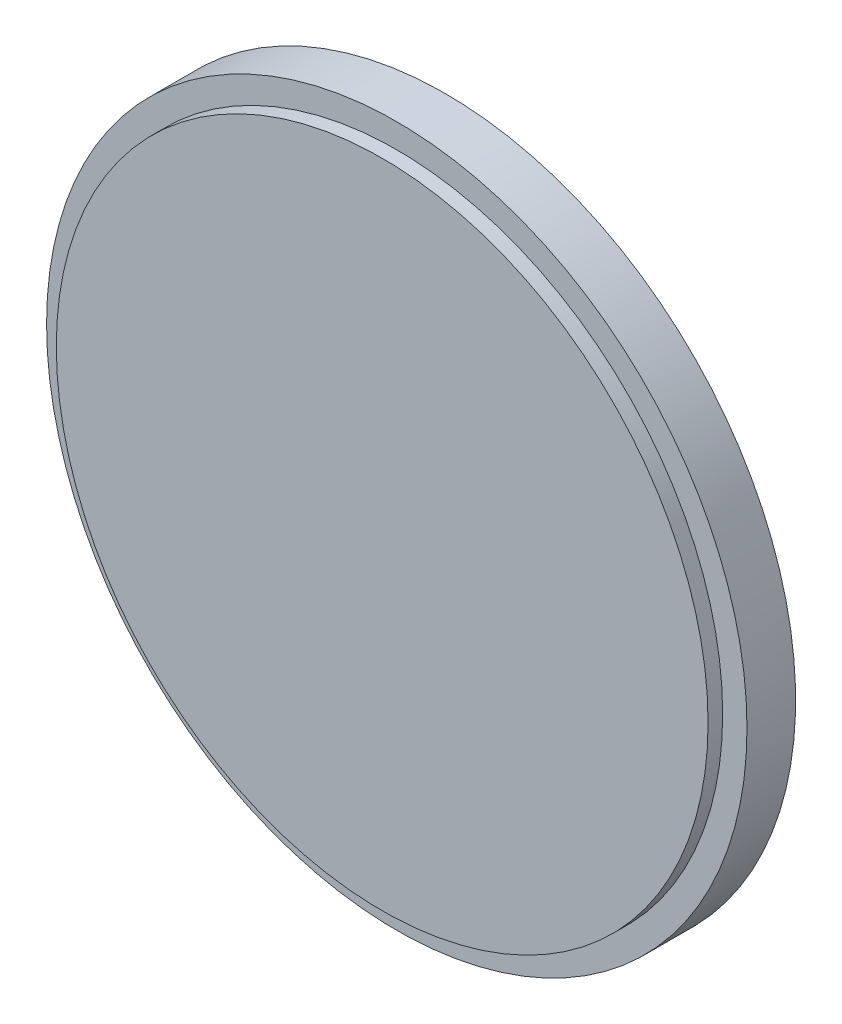
from build123d import *

# Parameters (mm, degrees)
ESBO_O1_R                     = 35
ESBO_O1_R_2                   = 32.5
RESSALTO_EXTRUS_O1_DEPTH      = 8
RESSALTO_EXTRUS_O2_START      = -3
ESBO_O2_R                     = 32.5
RESSALTO_EXTRUS_O2_DEPTH      = 3
ESBO_O3_R                     = 2.5
CORTE_EXTRUS_O1_DEPTH         = 3
RESSALTO_EXTRUS_O3_DEPTH      = 5
RESSALTO_EXTRUS_O3_DEPTH_BACK = 3
ESBO_O4_R                     = 37
ESBO_O4_R_2                   = 35
ESBO_O5_W                     = 1.8
ESBO_O5_H                     = 3
ESBO_O6_R                     = 12.55
RESSALTO_EXTRUS_O4_DEPTH      = 5
CORTE_EXTRUS_O2_DEPTH         = 53.933921071
CORTE_EXTRUS_O2_DEPTH_BACK    = 53.933921071
ESBO_O7_R                     = 7.55
RESSALTO_EXTRUS_O5_START      = -8
ESBO_O8_R                     = 37
ESBO_O8_R_2                   = 32.5
RESSALTO_EXTRUS_O5_DEPTH      = 8
ESBO_O9_R                     = 37
ESBO_O9_R_2                   = 33.5
CORTE_EXTRUS_O8_DEPTH         = 1.5
CORTE_EXTRUS_O9_START         = -1.5
ESBO_O12_R                    = 37
ESBO_O12_R_2                  = 33.5
CORTE_EXTRUS_O9_DEPTH         = 1.5
CORTE_EXTRUS_O10_START        = -10
ESBO_O13_R                    = 37
ESBO_O13_R_2                  = 36
CORTE_EXTRUS_O10_DEPTH        = 10
ESBO_O14_R                    = 37
ESBO_O14_R_2                  = 36
RESSALTO_EXTRUS_O6_DEPTH      = 5
ESBO_O15_R                    = 12.55
CORTE_EXTRUS_O11_DEPTH        = 53.933921071
ESBO_O16_R                    = 12.55
RESSALTO_EXTRUS_O7_DEPTH      = 3
ESBO_O17_R                    = 10
RESSALTO_EXTRUS_O8_DEPTH      = 16
ESBO_O18_R                    = 3.3
CORTE_EXTRUS_O12_DEPTH        = 16
ESBO_O19_W                    = 5.95
ESBO_O19_H                    = 2.65
CORTE_EXTRUS_O13_DEPTH        = 8
ESBO_O23_R                    = 37
ESBO_O23_R_2                  = 36
CORTE_EXTRUS_O15_DEPTH        = 54.798234172
ESBO_O24_R                    = 3.3
RESSALTO_EXTRUS_O9_DEPTH      = 11
CORTE_EXTRUS_O14_DEPTH        = 56.88103435
CORTE_EXTRUS_O14_DEPTH_BACK   = 56.88103435
ESBO_O21_R                    = 1.65


with BuildPart() as part:
    # Esboço1 → Ressalto-extrusão1 (new body)
    with BuildSketch(Plane.XY):
        Circle(ESBO_O1_R)
        Circle(ESBO_O1_R_2, mode=Mode.SUBTRACT)
    extrude(amount=RESSALTO_EXTRUS_O1_DEPTH)

    # Esboço2 → Ressalto-extrusão2 (add)
    with BuildSketch(Plane.XY.offset(8).offset(RESSALTO_EXTRUS_O2_START)):
        Circle(ESBO_O2_R)
    extrude(amount=RESSALTO_EXTRUS_O2_DEPTH)

    # Esboço3 → Corte-extrusão1 (cut)
    with BuildSketch(Plane.XY.offset(8)):
        Circle(ESBO_O3_R)
    extrude(amount=-CORTE_EXTRUS_O1_DEPTH, mode=Mode.SUBTRACT)

    # Esboço4 → Ressalto-extrusão3 (add, two sides: drawn at the far end of the back side and taken through both)
    with BuildSketch(Plane(origin=(0, 0, 5), x_dir=(-1, 0, 0), z_dir=(0, 0, -1)).offset(-RESSALTO_EXTRUS_O3_DEPTH_BACK)):
        Circle(ESBO_O4_R)
        Circle(ESBO_O4_R_2, mode=Mode.SUBTRACT)
    extrude(amount=RESSALTO_EXTRUS_O3_DEPTH + RESSALTO_EXTRUS_O3_DEPTH_BACK)

    # Esboço5 → Corte-Revolução1 (revolve, cut)
    with BuildSketch(Plane(origin=(0, 0, 0), x_dir=(1, 0, 0), z_dir=(0, 1, 0))):
        with Locations((-36.1, -2.5)):
            Rectangle(ESBO_O5_W, ESBO_O5_H)
        with Locations((-36.1, -5.5)):
            Rectangle(ESBO_O5_W, ESBO_O5_H)
    revolve(axis=Axis((0, 0, 8), (0, 0, -1)), mode=Mode.SUBTRACT)

    # Esboço6 → Ressalto-extrusão4 (add)
    with BuildSketch(Plane(origin=(0, 0, 5), x_dir=(-1, 0, 0), z_dir=(0, 0, -1))):
        with Locations(Location((0, 0, 0), (0, 0, 180))):
            Circle(ESBO_O6_R)
    extrude(amount=RESSALTO_EXTRUS_O4_DEPTH)

    # Esboço7 → Corte-extrusão2 (cut, two sides: drawn at the far end of the back side and taken through both)
    with BuildSketch(Plane(origin=(0, 0, 0), x_dir=(-1, 0, 0), z_dir=(0, 0, -1)).offset(-CORTE_EXTRUS_O2_DEPTH_BACK)):
        Circle(ESBO_O7_R)
    extrude(amount=CORTE_EXTRUS_O2_DEPTH + CORTE_EXTRUS_O2_DEPTH_BACK, mode=Mode.SUBTRACT)

    # Esboço8 → Ressalto-extrusão5 (add)
    with BuildSketch(Plane.XY.offset(8).offset(RESSALTO_EXTRUS_O5_START)):
        with Locations(Location((0, 0, 0), (0, 0, 180))):
            Circle(ESBO_O8_R)
        Circle(ESBO_O8_R_2, mode=Mode.SUBTRACT)
    extrude(amount=RESSALTO_EXTRUS_O5_DEPTH)

    # Esboço9 → Corte-extrusão8 (cut)
    with BuildSketch(Plane.XY.offset(8)):
        with Locations(Location((0, 0, 0), (0, 0, 180))):
            Circle(ESBO_O9_R)
        Circle(ESBO_O9_R_2, mode=Mode.SUBTRACT)
    extrude(amount=-CORTE_EXTRUS_O8_DEPTH, mode=Mode.SUBTRACT)

    # Esboço12 → Corte-extrusão9 (cut)
    with BuildSketch(Plane(origin=(0, 0, 0), x_dir=(-1, 0, 0), z_dir=(0, 0, -1)).offset(CORTE_EXTRUS_O9_START)):
        Circle(ESBO_O12_R)
        with Locations(Location((0, 0, 0), (0, 0, 180))):
            Circle(ESBO_O12_R_2, mode=Mode.SUBTRACT)
    extrude(amount=CORTE_EXTRUS_O9_DEPTH, mode=Mode.SUBTRACT)

    # Esboço13 → Corte-extrusão10 (cut)
    with BuildSketch(Plane(origin=(0, 0, 1.5), x_dir=(-1, 0, 0), z_dir=(0, 0, -1)).offset(CORTE_EXTRUS_O10_START)):
        Circle(ESBO_O13_R)
        Circle(ESBO_O13_R_2, mode=Mode.SUBTRACT)
    extrude(amount=CORTE_EXTRUS_O10_DEPTH, mode=Mode.SUBTRACT)

    # Esboço14 → Ressalto-extrusão6 (add)
    with BuildSketch(Plane.XY.offset(6.5)):
        Circle(ESBO_O14_R)
        Circle(ESBO_O14_R_2, mode=Mode.SUBTRACT)
    extrude(amount=-RESSALTO_EXTRUS_O6_DEPTH)

    # Esboço15 → Corte-extrusão11 (cut, through all)
    with BuildSketch(Plane(origin=(0, 0, 0), x_dir=(-1, 0, 0), z_dir=(0, 0, -1))):
        Circle(ESBO_O15_R)
    extrude(amount=-CORTE_EXTRUS_O11_DEPTH, mode=Mode.SUBTRACT)

    # Esboço16 → Ressalto-extrusão7 (add, through all)
    with BuildSketch(Plane(origin=(0, 0, 5), x_dir=(-1, 0, 0), z_dir=(0, 0, -1))):
        Circle(ESBO_O16_R)
    extrude(amount=-RESSALTO_EXTRUS_O7_DEPTH)

    # Esboço17 → Ressalto-extrusão8 (add)
    with BuildSketch(Plane(origin=(0, 0, 5), x_dir=(-1, 0, 0), z_dir=(0, 0, -1))):
        with Locations(Location((0, 0, 0), (0, 0, 180))):
            Circle(ESBO_O17_R)
    extrude(amount=RESSALTO_EXTRUS_O8_DEPTH)

    # Esboço18 → Corte-extrusão12 (cut)
    with BuildSketch(Plane(origin=(0, 0, -11), x_dir=(-1, 0, 0), z_dir=(0, 0, -1))):
        Circle(ESBO_O18_R)
    extrude(amount=-CORTE_EXTRUS_O12_DEPTH, mode=Mode.SUBTRACT)

    # Esboço19 → Corte-extrusão13 (cut)
    with BuildSketch(Plane(origin=(0, 0, -11), x_dir=(-1, 0, 0), z_dir=(0, 0, -1))):
        with Locations((0, -6.625)):
            Rectangle(ESBO_O19_W, ESBO_O19_H)
        with Locations((0, 6.625)):
            Rectangle(ESBO_O19_W, ESBO_O19_H)
    extrude(amount=-CORTE_EXTRUS_O13_DEPTH, mode=Mode.SUBTRACT)

    # Esboço23 → Corte-extrusão15 (cut, through all)
    with BuildSketch(Plane(origin=(0, 0, 1.5), x_dir=(-1, 0, 0), z_dir=(0, 0, -1))):
        Circle(ESBO_O23_R)
        Circle(ESBO_O23_R_2, mode=Mode.SUBTRACT)
    extrude(amount=-CORTE_EXTRUS_O15_DEPTH, mode=Mode.SUBTRACT)

    # Esboço24 → Ressalto-extrusão9 (add)
    with BuildSketch(Plane(origin=(0, 0, -11), x_dir=(-1, 0, 0), z_dir=(0, 0, -1))):
        Circle(ESBO_O24_R)
        with BuildLine():
            Line((-1.229837388, 1.1), (1.229837388, 1.1))
            ThreePointArc((1.229837388, 1.1), (0, -1.65), (-1.229837388, 1.1))
        make_face(mode=Mode.SUBTRACT)
    extrude(amount=-RESSALTO_EXTRUS_O9_DEPTH)

    # Esboço21 → Corte-extrusão14 (cut, two sides: drawn at the far end of the back side and taken through both)
    with BuildSketch(Plane(origin=(0, 5.3, 0), x_dir=(1, 0, 0), z_dir=(0, 1, 0)).offset(-CORTE_EXTRUS_O14_DEPTH_BACK)):
        with Locations((0, 6.85)):
            Circle(ESBO_O21_R)
    extrude(amount=CORTE_EXTRUS_O14_DEPTH + CORTE_EXTRUS_O14_DEPTH_BACK, mode=Mode.SUBTRACT)


solid = part.part
